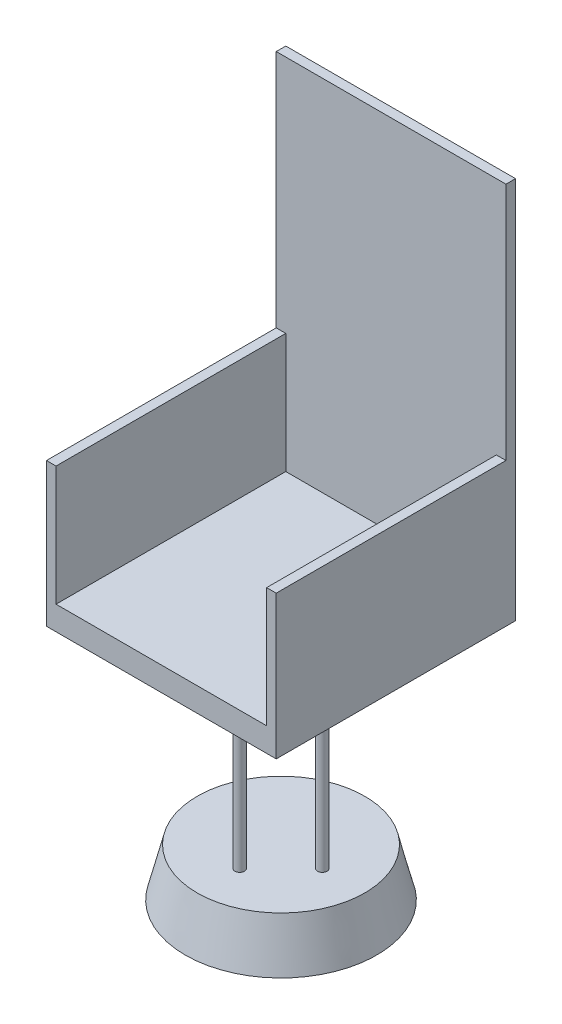
from build123d import *

# Parameters (mm, degrees)
SKETCH1_R            = 200
BOSS_EXTRUDE1_DEPTH  = 100
BOSS_EXTRUDE1_TAPER  = 14
SKETCH2_R            = 10
BOSS_EXTRUDE2_DEPTH  = 400
SKETCH7_W            = 480
SKETCH7_H            = 500
BOSS_EXTRUDE8_DEPTH  = 50
SKETCH8_W            = 480
SKETCH8_H            = 20
BOSS_EXTRUDE9_DEPTH  = 750
SKETCH9_W            = 20
SKETCH9_H            = 480
BOSS_EXTRUDE10_DEPTH = 250


with BuildPart() as part:
    # Sketch1 → Boss-Extrude1 (new body)
    with BuildSketch(Plane(origin=(0, 0, 0), x_dir=(1, 0, 0), z_dir=(0, 1, 0))):
        Circle(SKETCH1_R)
    extrude(amount=BOSS_EXTRUDE1_DEPTH, taper=BOSS_EXTRUDE1_TAPER)

    # Sketch2 → Boss-Extrude2 (add)
    with BuildSketch(Plane(origin=(0, 100, 0), x_dir=(1, 0, 0), z_dir=(0, 1, 0))):
        with Locations(Location((86.344755042, 0, 0), (0, 0, 270))):
            Circle(SKETCH2_R)
        with Locations(Location((0, -86.344755042, 0), (0, 0, 270))):
            Circle(SKETCH2_R)
        with Locations(Location((-86.344755042, 0, 0), (0, 0, 270))):
            Circle(SKETCH2_R)
        with Locations(Location((0, 86.344755042, 0), (0, 0, 270))):
            Circle(SKETCH2_R)
    extrude(amount=BOSS_EXTRUDE2_DEPTH)

    # Sketch7 → Boss-Extrude8 (add)
    with BuildSketch(Plane(origin=(0, 500, 0), x_dir=(1, 0, 0), z_dir=(0, 1, 0))):
        Rectangle(SKETCH7_W, SKETCH7_H)
    extrude(amount=BOSS_EXTRUDE8_DEPTH)

    # Sketch8 → Boss-Extrude9 (add)
    with BuildSketch(Plane(origin=(0, 550, 0), x_dir=(1, 0, 0), z_dir=(0, 1, 0))):
        with Locations((0, 240)):
            Rectangle(SKETCH8_W, SKETCH8_H)
    extrude(amount=BOSS_EXTRUDE9_DEPTH)

    # Sketch9 → Boss-Extrude10 (add)
    with BuildSketch(Plane(origin=(0, 550, 0), x_dir=(1, 0, 0), z_dir=(0, 1, 0))):
        with Locations((-230, -10)):
            Rectangle(SKETCH9_W, SKETCH9_H)
        with Locations((230, -10)):
            Rectangle(SKETCH9_W, SKETCH9_H)
    extrude(amount=BOSS_EXTRUDE10_DEPTH)


solid = part.part
